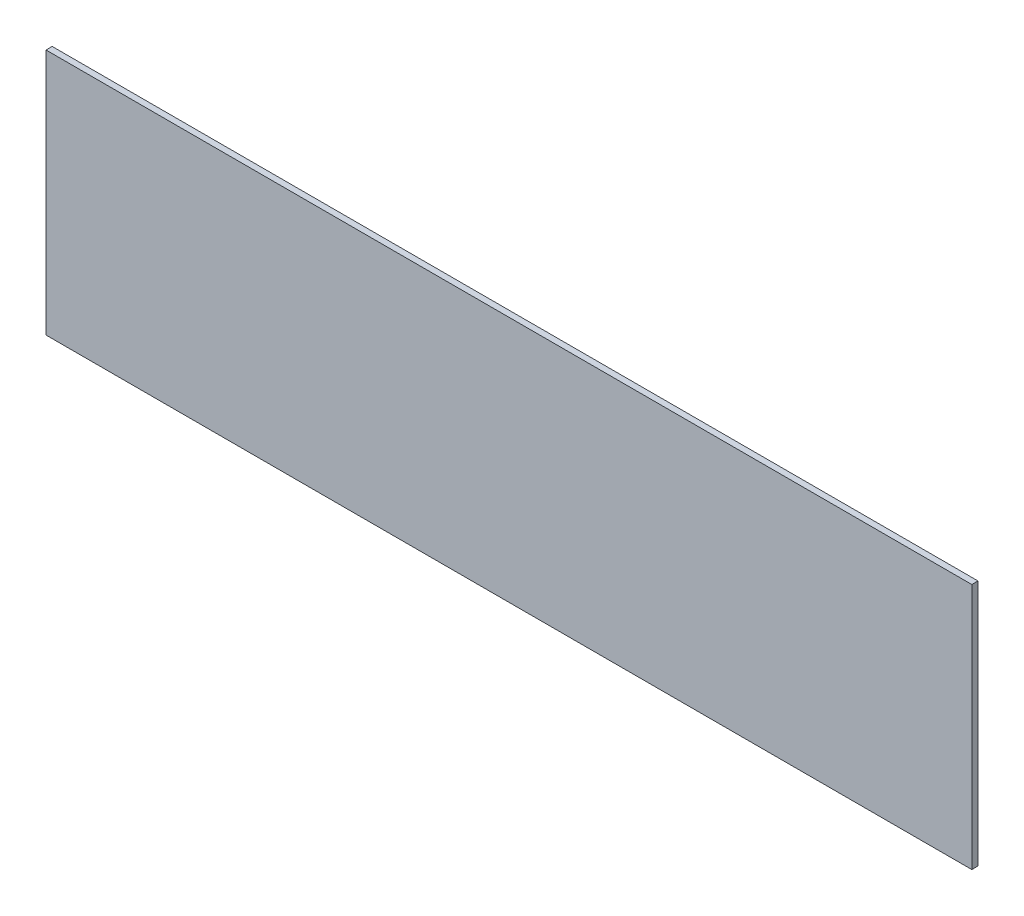
from build123d import *

# Parameters (mm, degrees)
SKETCH1_W           = 1500
SKETCH1_H           = 400
BOSS_EXTRUDE1_DEPTH = 10


with BuildPart() as part:
    # Sketch1 → Boss-Extrude1 (new body)
    with BuildSketch(Plane.XY):
        Rectangle(SKETCH1_W, SKETCH1_H)
    extrude(amount=BOSS_EXTRUDE1_DEPTH)


solid = part.part
